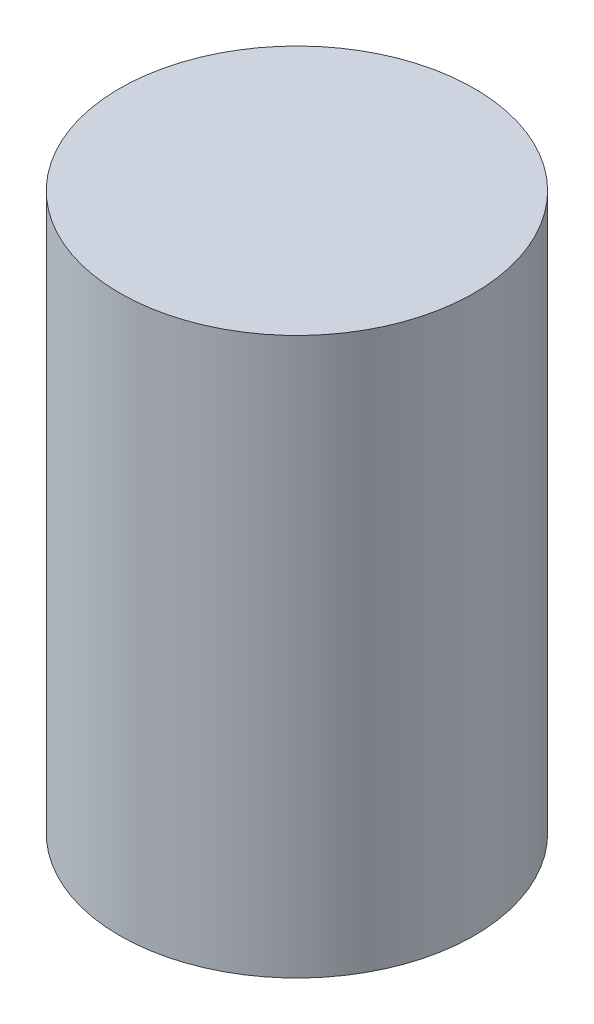
from build123d import *

# Parameters (mm, degrees)
SKETCH1_R           = 13.882781918
BOSS_EXTRUDE1_DEPTH = 43.579763043


with BuildPart() as part:
    # Sketch1 → Boss-Extrude1 (new body)
    with BuildSketch(Plane(origin=(0, 0, 0), x_dir=(1, 0, 0), z_dir=(0, 1, 0))):
        with Locations(Location((0, 0, 0), (0, 0, 270))):
            Circle(SKETCH1_R)
    extrude(amount=BOSS_EXTRUDE1_DEPTH)


solid = part.part
